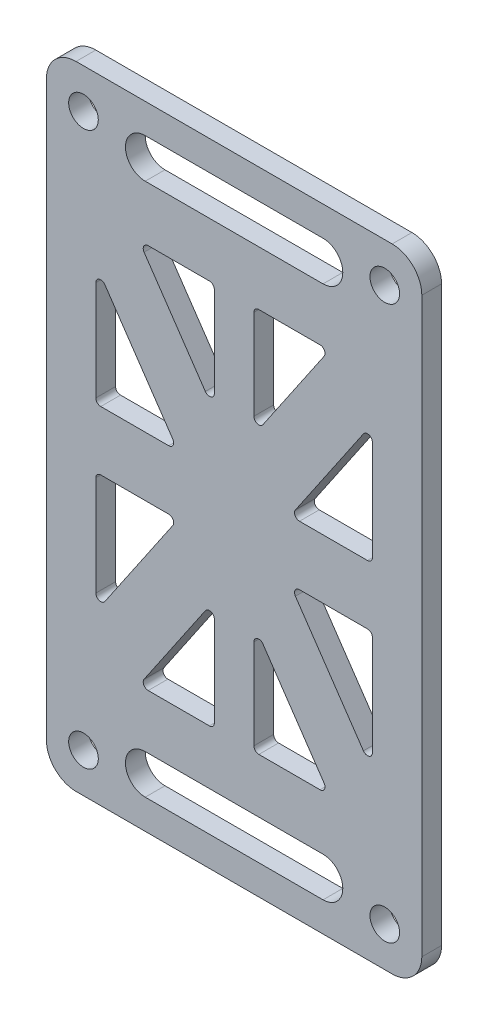
from build123d import *

# Parameters (mm, degrees)
SKETCH_1_R      = 1.5
EXTRUDE_1_DEPTH = 2


with BuildPart() as part:
    # 草图1 → 凸台-拉伸1 (new body)
    with BuildSketch(Plane.XY):
        with BuildLine():
            Line((-16, 32), (16, 32))
            ThreePointArc((16, 32), (18.121320344, 31.121320344), (19, 29))
            Line((19, 29), (19, -29))
            ThreePointArc((19, -29), (18.121320344, -31.121320344), (16, -32))
            Line((16, -32), (-16, -32))
            ThreePointArc((-16, -32), (-18.121320344, -31.121320344), (-19, -29))
            Line((-19, -29), (-19, 29))
            ThreePointArc((-19, 29), (-18.121320344, 31.121320344), (-16, 32))
        make_face()
        with Locations((-15.25, 28)):
            Circle(SKETCH_1_R, mode=Mode.SUBTRACT)
        with Locations(Location((15.25, 28, 0), (0, 0, 180))):
            Circle(SKETCH_1_R, mode=Mode.SUBTRACT)
        with Locations((15.25, -28)):
            Circle(SKETCH_1_R, mode=Mode.SUBTRACT)
        with Locations(Location((-15.25, -28, 0), (0, 0, 180))):
            Circle(SKETCH_1_R, mode=Mode.SUBTRACT)
        with BuildLine():
            Line((-9, -25), (9, -25))
            ThreePointArc((9, -25), (11, -27), (9, -29))
            Line((9, -29), (-9, -29))
            ThreePointArc((-9, -29), (-11, -27), (-9, -25))
        make_face(mode=Mode.SUBTRACT)
        with BuildLine():
            Line((-9, 25), (9, 25))
            ThreePointArc((9, 25), (11, 27), (9, 29))
            Line((9, 29), (-9, 29))
            ThreePointArc((-9, 29), (-11, 27), (-9, 25))
        make_face(mode=Mode.SUBTRACT)
        with BuildLine():
            Line((-6.617195014, 3), (-13.5, 3))
            ThreePointArc((-13.5, 3), (-13.853553391, 3.146446609), (-14, 3.5))
            Line((-14, 3.5), (-14, 13.609119823))
            ThreePointArc((-14, 13.609119823), (-13.647224638, 14.086953378), (-13.086700376, 13.890515312))
            Line((-13.086700376, 13.890515312), (-6.20389539, 3.781395489))
            ThreePointArc((-6.20389539, 3.781395489), (-6.175212127, 3.266224193), (-6.617195014, 3))
        make_face(mode=Mode.SUBTRACT)
        with BuildLine():
            Line((14, 3.5), (14, 13.609119823))
            ThreePointArc((14, 13.609119823), (13.647224638, 14.086953378), (13.086700376, 13.890515312))
            Line((13.086700376, 13.890515312), (6.20389539, 3.781395489))
            ThreePointArc((6.20389539, 3.781395489), (6.175212127, 3.266224193), (6.617195014, 3))
            Line((6.617195014, 3), (13.5, 3))
            ThreePointArc((13.5, 3), (13.853553391, 3.146446609), (14, 3.5))
        make_face(mode=Mode.SUBTRACT)
        with BuildLine():
            Line((6.617195014, -3), (13.5, -3))
            ThreePointArc((13.5, -3), (13.853553391, -3.146446609), (14, -3.5))
            Line((14, -3.5), (14, -13.609119823))
            ThreePointArc((14, -13.609119823), (13.647224638, -14.086953378), (13.086700376, -13.890515312))
            Line((13.086700376, -13.890515312), (6.20389539, -3.781395489))
            ThreePointArc((6.20389539, -3.781395489), (6.175212127, -3.266224193), (6.617195014, -3))
        make_face(mode=Mode.SUBTRACT)
        with BuildLine():
            Line((-14, -3.5), (-14, -13.609119823))
            ThreePointArc((-14, -13.609119823), (-13.647224638, -14.086953378), (-13.086700376, -13.890515312))
            Line((-13.086700376, -13.890515312), (-6.20389539, -3.781395489))
            ThreePointArc((-6.20389539, -3.781395489), (-6.175212127, -3.266224193), (-6.617195014, -3))
            Line((-6.617195014, -3), (-13.5, -3))
            ThreePointArc((-13.5, -3), (-13.853553391, -3.146446609), (-14, -3.5))
        make_face(mode=Mode.SUBTRACT)
        with BuildLine():
            Line((-8.701953922, 19.5), (-2.5, 19.5))
            ThreePointArc((-2.5, 19.5), (-2.146446609, 19.353553391), (-2, 19))
            Line((-2, 19), (-2, 9.890880177))
            ThreePointArc((-2, 9.890880177), (-2.352775362, 9.413046622), (-2.913299624, 9.609484688))
            Line((-2.913299624, 9.609484688), (-9.115253546, 18.718604511))
            ThreePointArc((-9.115253546, 18.718604511), (-9.143936809, 19.233775807), (-8.701953922, 19.5))
        make_face(mode=Mode.SUBTRACT)
        with BuildLine():
            Line((2, 19), (2, 9.890880177))
            ThreePointArc((2, 9.890880177), (2.352775362, 9.413046622), (2.913299624, 9.609484688))
            Line((2.913299624, 9.609484688), (9.115253546, 18.718604511))
            ThreePointArc((9.115253546, 18.718604511), (9.143936809, 19.233775807), (8.701953922, 19.5))
            Line((8.701953922, 19.5), (2.5, 19.5))
            ThreePointArc((2.5, 19.5), (2.146446609, 19.353553391), (2, 19))
        make_face(mode=Mode.SUBTRACT)
        with BuildLine():
            Line((8.701953922, -19.5), (2.5, -19.5))
            ThreePointArc((2.5, -19.5), (2.146446609, -19.353553391), (2, -19))
            Line((2, -19), (2, -9.890880177))
            ThreePointArc((2, -9.890880177), (2.352775362, -9.413046622), (2.913299624, -9.609484688))
            Line((2.913299624, -9.609484688), (9.115253546, -18.718604511))
            ThreePointArc((9.115253546, -18.718604511), (9.143936809, -19.233775807), (8.701953922, -19.5))
        make_face(mode=Mode.SUBTRACT)
        with BuildLine():
            Line((-2, -19), (-2, -9.890880177))
            ThreePointArc((-2, -9.890880177), (-2.352775362, -9.413046622), (-2.913299624, -9.609484688))
            Line((-2.913299624, -9.609484688), (-9.115253546, -18.718604511))
            ThreePointArc((-9.115253546, -18.718604511), (-9.143936809, -19.233775807), (-8.701953922, -19.5))
            Line((-8.701953922, -19.5), (-2.5, -19.5))
            ThreePointArc((-2.5, -19.5), (-2.146446609, -19.353553391), (-2, -19))
        make_face(mode=Mode.SUBTRACT)
    extrude(amount=EXTRUDE_1_DEPTH)


solid = part.part
